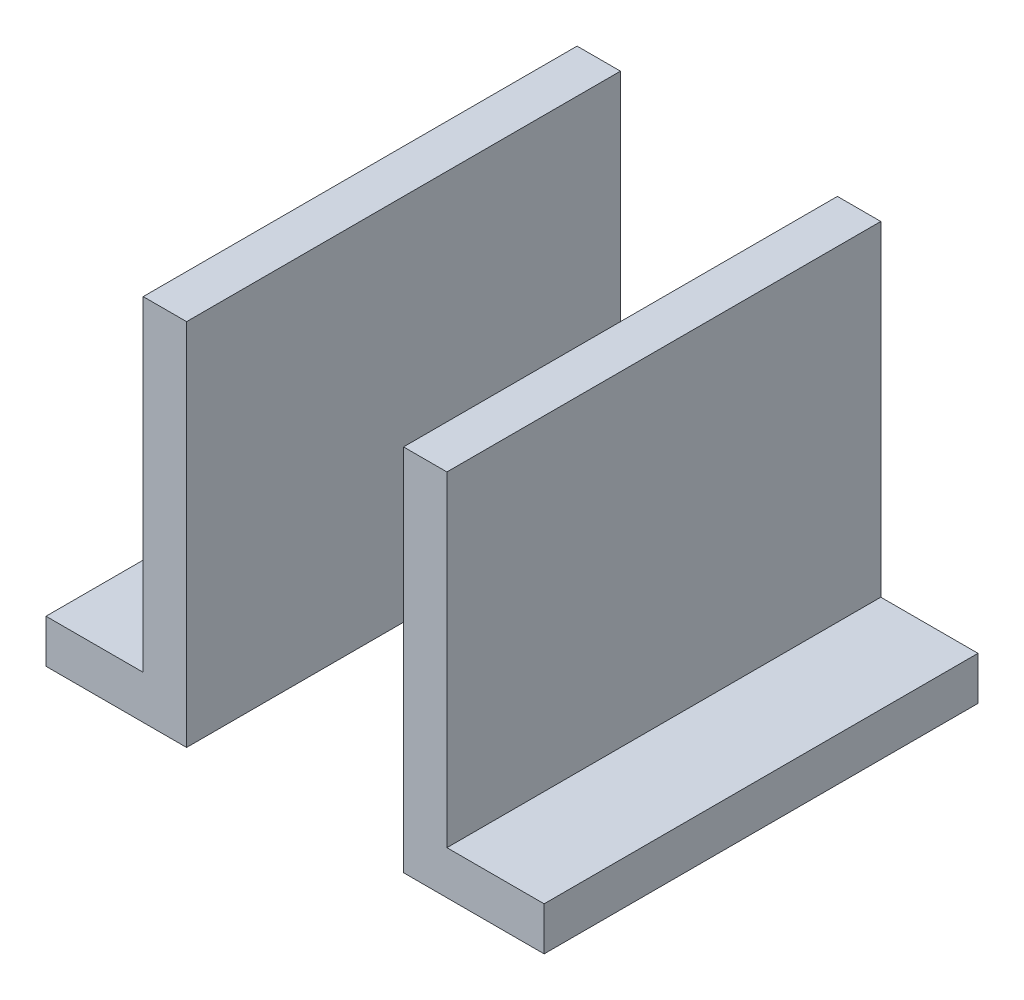
from build123d import *

# Parameters (mm, degrees)
BOSS_EXTRUDE1_DEPTH   = 100
BOSS_EXTRUDE1_2_DEPTH = 100


with BuildPart() as part:
    # Sketch1 → Boss-Extrude1 (new body)
    with BuildSketch(Plane.XY):
        Polygon((-57.404010399, -45.485546177), (-25, -45.485546177), (-25, 39.514453823), (-35, 39.514453823), (-35, -35.485546177), (-57.404010399, -35.485546177), align=None)
    extrude(amount=BOSS_EXTRUDE1_DEPTH)


with BuildPart() as body_2:
    # Sketch1 → Boss-Extrude1 2 (new body)
    with BuildSketch(Plane.XY):
        Polygon((25, 39.514453823), (35, 39.514453823), (35, -35.485546177), (57.404010399, -35.485546177), (57.404010399, -45.485546177), (25, -45.485546177), align=None)
    extrude(amount=BOSS_EXTRUDE1_2_DEPTH)


solid = Compound([part.part, body_2.part])
